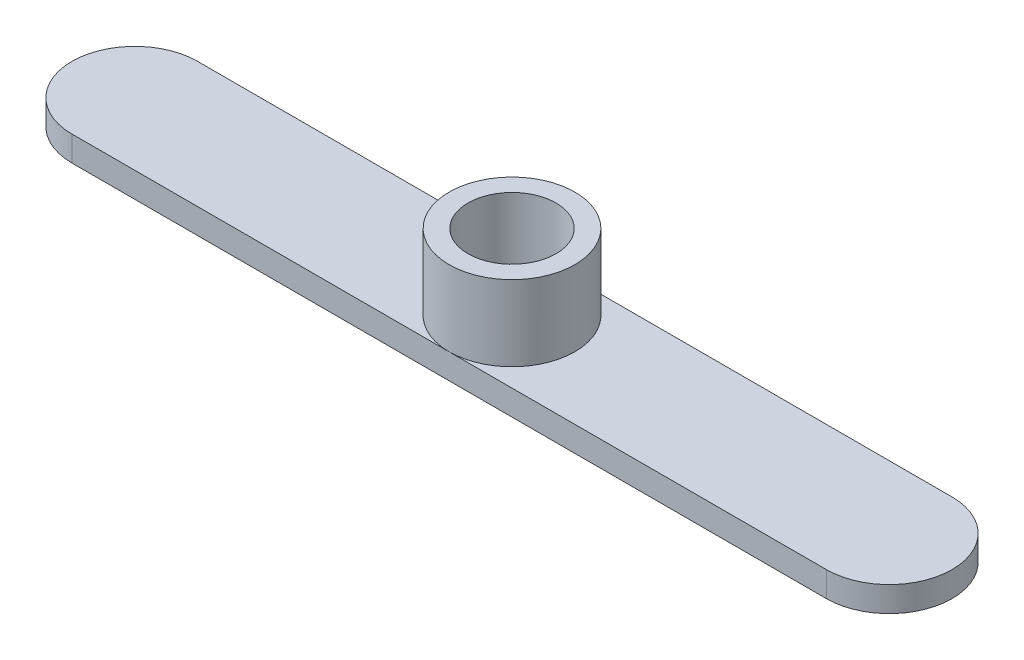
from build123d import *

# Parameters (mm, degrees)
EXTRUDE_1_DEPTH     = 1
SKETCH_2_R          = 2.5
SKETCH_2_R_2        = 1.75
EXTRUDE_2_DEPTH     = 4
SKETCH_3_R          = 1
CUT_EXTRUDE_1_DEPTH = 4
SKETCH_4_R          = 1.5
CUT_EXTRUDE_2_DEPTH = 0.5


with BuildPart() as part:
    # 草图1 → 凸台-拉伸1 (new body)
    with BuildSketch(Plane(origin=(0, 0, 0), x_dir=(1, 0, 0), z_dir=(0, 1, 0))):
        with BuildLine():
            Line((-15, 2.5), (15, 2.5))
            ThreePointArc((15, 2.5), (17.5, 0), (15, -2.5))
            Line((15, -2.5), (-15, -2.5))
            ThreePointArc((-15, -2.5), (-17.5, 0), (-15, 2.5))
        make_face()
    extrude(amount=EXTRUDE_1_DEPTH)

    # 草图2 → 凸台-拉伸2 (add)
    with BuildSketch(Plane(origin=(0, 0, 0), x_dir=(1, 0, 0), z_dir=(0, 1, 0))):
        with Locations(Location((0, 0, 0), (0, 0, 270))):
            Circle(SKETCH_2_R)
        with Locations(Location((0, 0, 0), (0, 0, 270))):
            Circle(SKETCH_2_R_2, mode=Mode.SUBTRACT)
    extrude(amount=EXTRUDE_2_DEPTH)

    # 草图3 → 切除-拉伸1 (cut)
    with BuildSketch(Plane(origin=(0, 0, 0), x_dir=(1, 0, 0), z_dir=(0, 1, 0))):
        with Locations(Location((0, 0, 0), (0, 0, 270))):
            Circle(SKETCH_3_R)
    extrude(amount=CUT_EXTRUDE_1_DEPTH, mode=Mode.SUBTRACT)

    # 草图4 → 切除-拉伸2 (cut)
    with BuildSketch(Plane(origin=(0, 0, 0), x_dir=(1, 0, 0), z_dir=(0, 1, 0))):
        with Locations(Location((0, 0, 0), (0, 0, 270))):
            Circle(SKETCH_4_R)
    extrude(amount=CUT_EXTRUDE_2_DEPTH, mode=Mode.SUBTRACT)


solid = part.part
